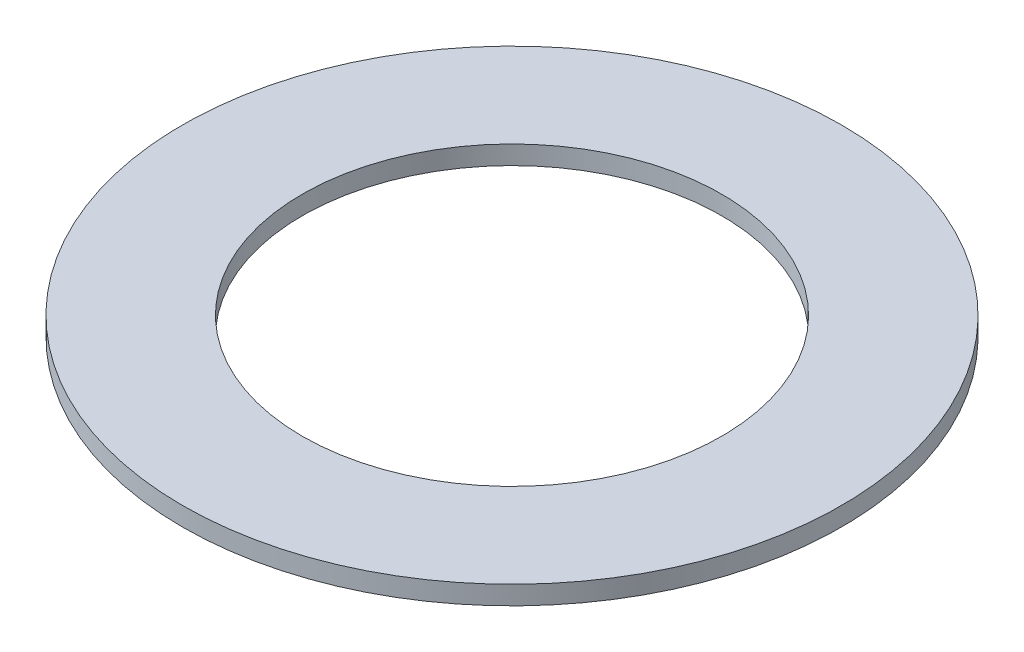
from build123d import *

# Parameters (mm, degrees)
SKETCH1_R           = 4.4
SKETCH1_R_2         = 2.8
BOSS_EXTRUDE1_DEPTH = 0.125


with BuildPart() as part:
    # Sketch1 → Boss-Extrude1 (new, symmetric)
    with BuildSketch(Plane(origin=(0, 0, 0), x_dir=(1, 0, 0), z_dir=(0, 1, 0))):
        with Locations(Location((0, 0, 0), (0, 0, 270))):
            Circle(SKETCH1_R)
        with Locations(Location((0, 0, 0), (0, 0, 270))):
            Circle(SKETCH1_R_2, mode=Mode.SUBTRACT)
    extrude(amount=BOSS_EXTRUDE1_DEPTH, both=True)


solid = part.part
